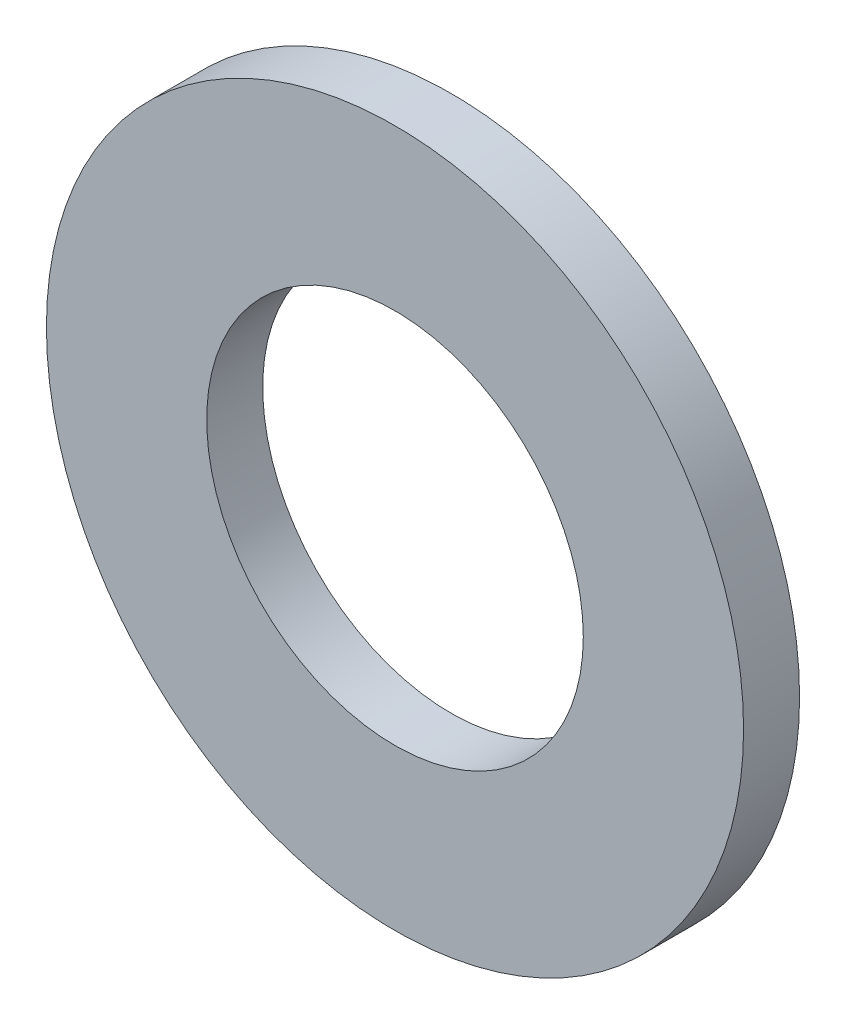
from build123d import *

# Parameters (mm, degrees)
SKETCH1_R      = 6.3246
SKETCH1_R_2    = 3.4163
EXTRUDE1_DEPTH = 1.016


with BuildPart() as part:
    # Sketch1 → Extrude1 (new body)
    with BuildSketch(Plane.XY):
        Circle(SKETCH1_R)
        Circle(SKETCH1_R_2, mode=Mode.SUBTRACT)
    extrude(amount=EXTRUDE1_DEPTH)


solid = part.part
